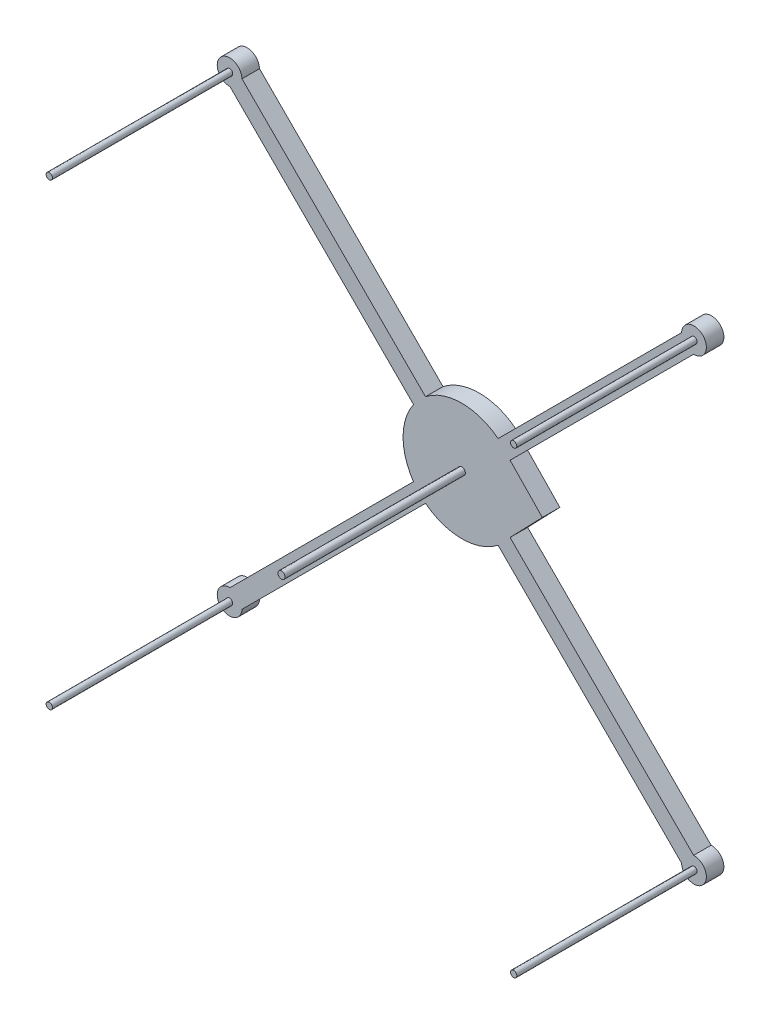
from build123d import *

# Parameters (mm, degrees)
BOSS_EXTRUDE1_DEPTH = 10
SKETCH3_R           = 1.796885627
SKETCH3_R_2         = 2.038704301
BOSS_EXTRUDE2_DEPTH = 113


with BuildPart() as part:
    # Sketch2 → Boss-Extrude1 (new body)
    with BuildSketch(Plane.XY):
        with BuildLine():
            Line((-20.72228509, 26.381237071), (-125.55357923, 131.212531212))
            ThreePointArc((-125.55357923, 131.212531212), (-137.769587184, 135.843703419), (-132.41170091, 123.928517268))
            Line((-132.41170091, 123.928517268), (-27.580406769, 19.097223127))
            ThreePointArc((-27.580406769, 19.097223127), (-33.546725157, 0), (-27.580406769, -19.097223127))
            Line((-27.580406769, -19.097223127), (-132.41170091, -123.928517268))
            ThreePointArc((-132.41170091, -123.928517268), (-137.769587184, -135.843703419), (-125.55357923, -131.212531212))
            Line((-125.55357923, -131.212531212), (-20.72228509, -26.381237071))
            ThreePointArc((-20.72228509, -26.381237071), (0, -33.546725157), (20.72228509, -26.381237071))
            Line((20.72228509, -26.381237071), (125.55357923, -131.212531212))
            ThreePointArc((125.55357923, -131.212531212), (137.769587184, -135.843703419), (132.41170091, -123.928517268))
            Line((132.41170091, -123.928517268), (27.580406769, -19.097223127))
            Line((27.580406769, -19.097223127), (46.005003751, 0))
            Line((46.005003751, 0), (27.580406769, 19.097223127))
            Line((27.580406769, 19.097223127), (132.41170091, 123.928517268))
            ThreePointArc((132.41170091, 123.928517268), (137.769587184, 135.843703419), (125.55357923, 131.212531212))
            Line((125.55357923, 131.212531212), (20.72228509, 26.381237071))
            ThreePointArc((20.72228509, 26.381237071), (0, 33.546725157), (-20.72228509, 26.381237071))
        make_face()
    extrude(amount=BOSS_EXTRUDE1_DEPTH)

    # Sketch3 → Boss-Extrude2 (add)
    with BuildSketch(Plane.XY):
        with Locations((-132.621345525, 130.996476601)):
            Circle(SKETCH3_R)
        with Locations(Location((132.621345525, 130.996476601, 0), (0, 0, 180))):
            Circle(SKETCH3_R)
        with Locations((132.621345525, -130.996476601)):
            Circle(SKETCH3_R)
        with Locations(Location((-132.621345525, -130.996476601, 0), (0, 0, 180))):
            Circle(SKETCH3_R)
        Circle(SKETCH3_R_2)
    extrude(amount=BOSS_EXTRUDE2_DEPTH)


solid = part.part
